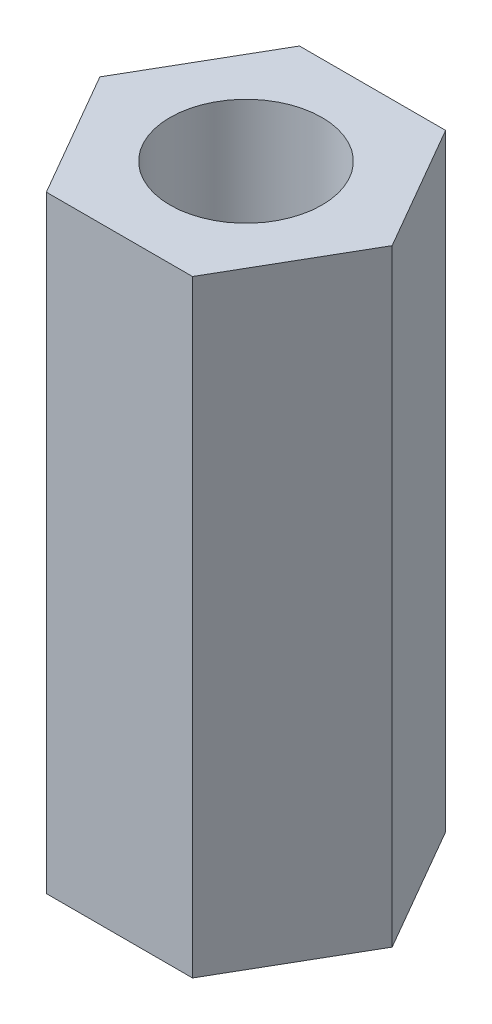
from build123d import *

# Parameters (mm, degrees)
CROQUIS1_R              = 1.5
SALIENTE_EXTRUIR1_DEPTH = 6


with BuildPart() as part:
    # Croquis1 → Saliente-Extruir1 (new, symmetric)
    with BuildSketch(Plane(origin=(0, 0, 0), x_dir=(1, 0, 0), z_dir=(0, 1, 0))):
        Polygon((1.443375673, -2.5), (2.886751346, 0), (1.443375673, 2.5), (-1.443375673, 2.5), (-2.886751346, 0), (-1.443375673, -2.5), align=None)
        with Locations(Location((0, 0, 0), (0, 0, 270))):
            Circle(CROQUIS1_R, mode=Mode.SUBTRACT)
    extrude(amount=SALIENTE_EXTRUIR1_DEPTH, both=True)


solid = part.part
